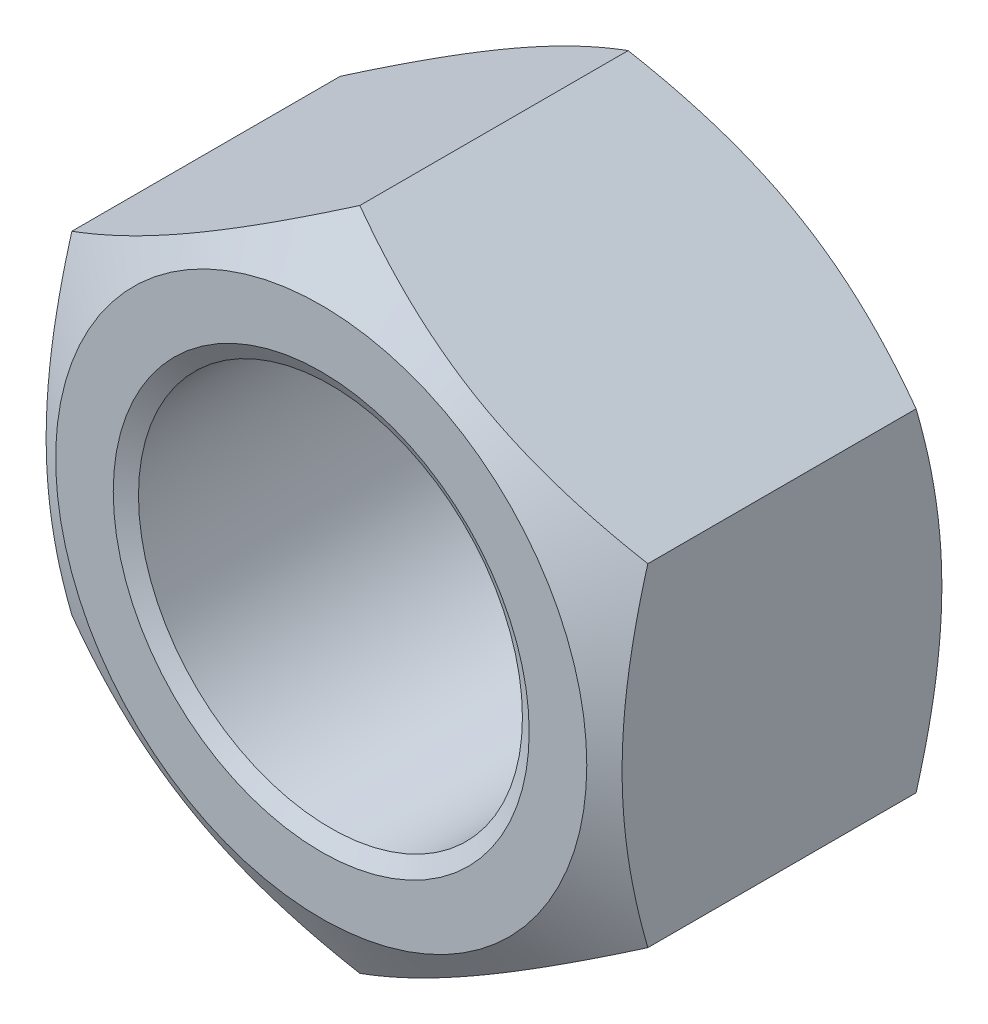
from build123d import *
from OCP.BRepFilletAPI import BRepFilletAPI_MakeChamfer

# Parameters (mm, degrees)
SZKIC1_R                    = 6
DODANIE_WYCI_GNI_CIE1_DEPTH = 10.8
SZKIC2_OUTSIDE_W            = 89.934
SZKIC2_OUTSIDE_H            = 92.718
SZKIC2_OUTSIDE_R            = 8.3
WYTNIJ_WYCI_GNI_CIE1_DEPTH  = 18.482562741
WYTNIJ_WYCI_GNI_CIE1_DRAFT  = -60
SZKIC3_OUTSIDE_W            = 89.934
SZKIC3_OUTSIDE_H            = 92.718
SZKIC3_OUTSIDE_R            = 8.3
WYTNIJ_WYCI_GNI_CIE3_DEPTH  = 18.482562741
WYTNIJ_WYCI_GNI_CIE3_DRAFT  = -60
SFAZOWANIE2_SIZE            = 0.5
SFAZOWANIE2_SIZE2           = 0.288675135


with BuildPart() as part:
    # Szkic1 → Dodanie-wyciągnięcie1 (new body)
    with BuildSketch(Plane.XY):
        Polygon((0, 10.392304845), (-9, 5.196152423), (-9, -5.196152423), (0, -10.392304845), (9, -5.196152423), (9, 5.196152423), align=None)
        with Locations(Location((0, 0, 0), (0, 0, 180))):
            Circle(SZKIC1_R, mode=Mode.SUBTRACT)
    extrude(amount=DODANIE_WYCI_GNI_CIE1_DEPTH)


with BuildPart() as wytnij_wyci_gni_cie1_tool:
    # Szkic2 outside → Wytnij-wyciągnięcie1 (with draft: the straight prism first)
    with BuildSketch(Plane.XY.offset(10.8)):
        Rectangle(SZKIC2_OUTSIDE_W, SZKIC2_OUTSIDE_H)
        Circle(SZKIC2_OUTSIDE_R, mode=Mode.SUBTRACT)
    extrude(amount=-WYTNIJ_WYCI_GNI_CIE1_DEPTH)
    # Wytnij-wyciągnięcie1: the draft: its side faces are tilted about the plane it starts from
    wytnij_wyci_gni_cie1_sides = [wytnij_wyci_gni_cie1_tool.faces().sort_by_distance(p)[0] for p in [
        (0, -46.359, 1.558718629),
        (44.967, 0, 1.558718629),
        (0, 46.359, 1.558718629),
        (-44.967, 0, 1.558718629),
        (-8.3, 0, 1.558718629),
    ]]
    draft(wytnij_wyci_gni_cie1_sides, Plane.XY.offset(10.8), WYTNIJ_WYCI_GNI_CIE1_DRAFT)


with BuildPart() as part_1:
    add(part.part)

    # Wytnij-wyciągnięcie1: cut by wytnij_wyci_gni_cie1_tool
    add(wytnij_wyci_gni_cie1_tool.part, mode=Mode.SUBTRACT)


with BuildPart() as wytnij_wyci_gni_cie3_tool:
    # Szkic3 outside → Wytnij-wyciągnięcie3 (with draft: the straight prism first)
    with BuildSketch(Plane(origin=(0, 0, 0), x_dir=(-1, 0, 0), z_dir=(0, 0, -1))):
        Rectangle(SZKIC3_OUTSIDE_W, SZKIC3_OUTSIDE_H)
        Circle(SZKIC3_OUTSIDE_R, mode=Mode.SUBTRACT)
    extrude(amount=-WYTNIJ_WYCI_GNI_CIE3_DEPTH)
    # Wytnij-wyciągnięcie3: the draft: its side faces are tilted about the plane it starts from
    wytnij_wyci_gni_cie3_sides = [wytnij_wyci_gni_cie3_tool.faces().sort_by_distance(p)[0] for p in [
        (0, -46.359, 9.241281371),
        (-44.967, 0, 9.241281371),
        (0, 46.359, 9.241281371),
        (44.967, 0, 9.241281371),
        (8.3, 0, 9.241281371),
    ]]
    draft(wytnij_wyci_gni_cie3_sides, Plane(origin=(0, 0, 0), x_dir=(-1, 0, 0), z_dir=(0, 0, -1)), WYTNIJ_WYCI_GNI_CIE3_DRAFT)


with BuildPart() as part_2:
    add(part_1.part)

    # Wytnij-wyciągnięcie3: cut by wytnij_wyci_gni_cie3_tool
    add(wytnij_wyci_gni_cie3_tool.part, mode=Mode.SUBTRACT)

    # Sfazowanie2: one chamfer whose edges measure the first distance from different faces: ONE call of the kernel's chamfer builder (chamfer() names one face for all edges)
    sfazowanie2_edges_1 = [part_2.edges().sort_by_distance(p)[0] for p in [
        (6, 0, 0),
    ]]
    sfazowanie2_side_1 = [part_2.faces().sort_by_distance(p)[0] for p in [
        (6, 0, 5.4),
    ]]
    sfazowanie2_edges_2 = [part_2.edges().sort_by_distance(p)[0] for p in [
        (6, 0, 10.8),
    ]]
    sfazowanie2_side_2 = [part_2.faces().sort_by_distance(p)[0] for p in [
        (-8.065240549, 0, 10.8),
    ]]
    sfazowanie2 = BRepFilletAPI_MakeChamfer(part_2.part.solid().wrapped)
    for e in sfazowanie2_edges_1:
        sfazowanie2.Add(SFAZOWANIE2_SIZE, SFAZOWANIE2_SIZE2, e.wrapped, sfazowanie2_side_1[0].wrapped)  # the first distance lies on this face
    for e in sfazowanie2_edges_2:
        sfazowanie2.Add(SFAZOWANIE2_SIZE, SFAZOWANIE2_SIZE2, e.wrapped, sfazowanie2_side_2[0].wrapped)  # the first distance lies on this face
    add(Compound.cast(sfazowanie2.Shape()), mode=Mode.REPLACE)


solid = part_2.part
